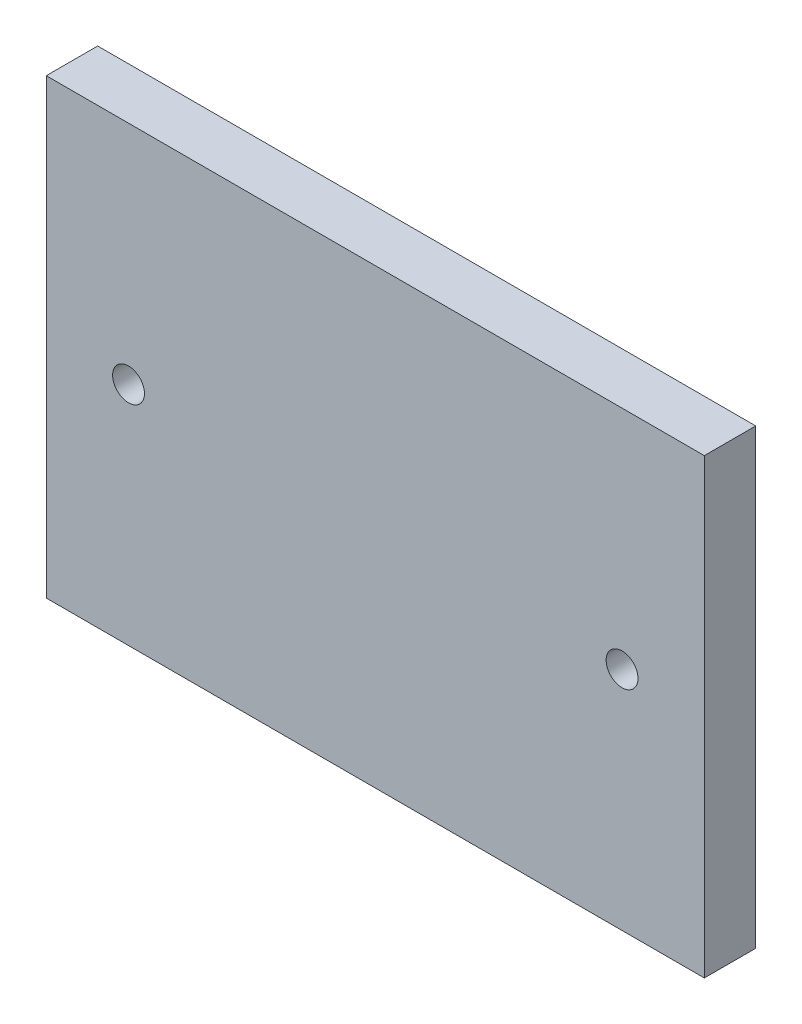
from build123d import *

# Parameters (mm, degrees)
F_5MM_START          = 27
SKETCH_1_W           = 64
SKETCH_1_H           = 44
F_5MM_DEPTH          = 5
CUT_EXTRUDE_START    = 27
SKETCH_2_R           = 1.55
CUT_EXTRUDE_48_DEPTH = 5


with BuildPart() as part:
    # 草图1 → 模拟5mm车架_非整车底板模型 (new body)
    with BuildSketch(Plane.XY.offset(F_5MM_START)):
        Rectangle(SKETCH_1_W, SKETCH_1_H)
    extrude(amount=F_5MM_DEPTH)

    # 草图2 → 检具48孔距 (cut)
    with BuildSketch(Plane.XY.offset(CUT_EXTRUDE_START)):
        with Locations((-24, 0)):
            Circle(SKETCH_2_R)
        with Locations((24, 0)):
            Circle(SKETCH_2_R)
    extrude(amount=CUT_EXTRUDE_48_DEPTH, mode=Mode.SUBTRACT)


solid = part.part
